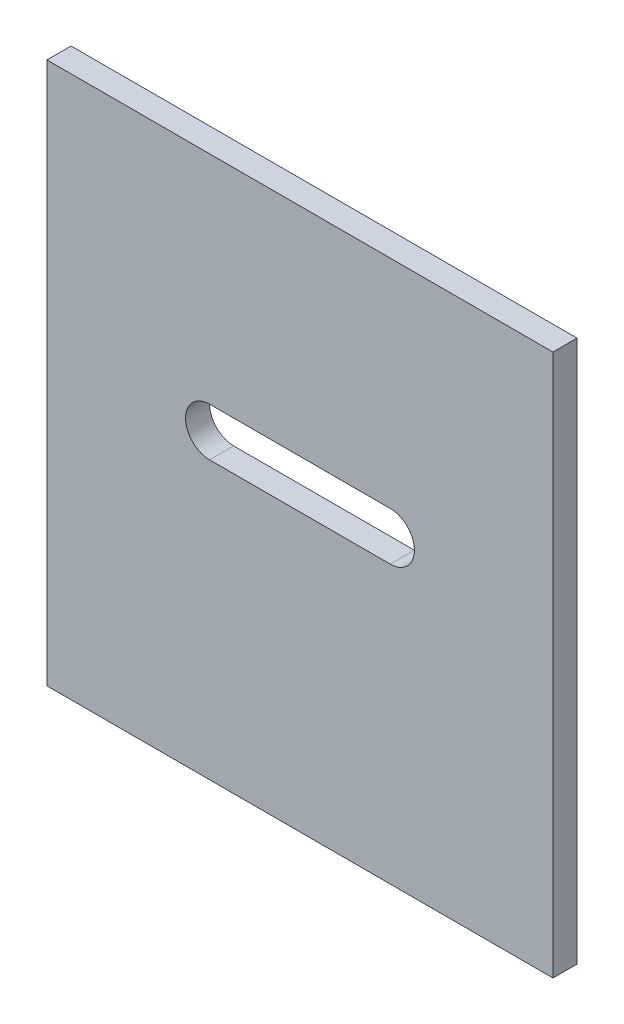
from build123d import *

# Parameters (mm, degrees)
SKETCH1_W           = 42
SKETCH1_H           = 45
BOSS_EXTRUDE1_DEPTH = 2
CUT_EXTRUDE1_DEPTH  = 2


with BuildPart() as part:
    # Sketch1 → Boss-Extrude1 (new body)
    with BuildSketch(Plane.XY):
        Rectangle(SKETCH1_W, SKETCH1_H)
    extrude(amount=BOSS_EXTRUDE1_DEPTH)

    # Sketch2 → Cut-Extrude1 (cut)
    with BuildSketch(Plane.XY.offset(2)):
        with BuildLine():
            Line((-7.5, 4.5), (7.5, 4.5))
            ThreePointArc((7.5, 4.5), (9.5, 2.5), (7.5, 0.5))
            Line((7.5, 0.5), (-7.5, 0.5))
            ThreePointArc((-7.5, 0.5), (-9.5, 2.5), (-7.5, 4.5))
        make_face()
    extrude(amount=-CUT_EXTRUDE1_DEPTH, mode=Mode.SUBTRACT)


solid = part.part
